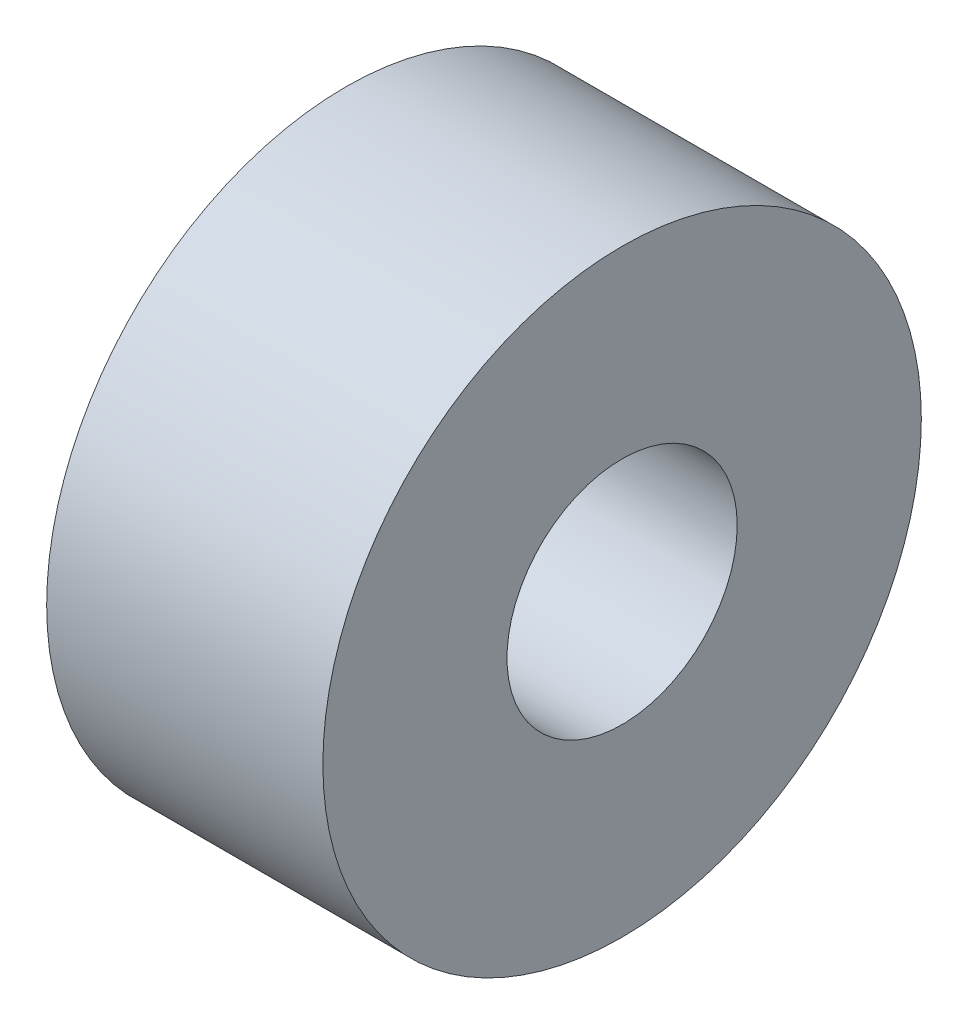
from build123d import *

# Parameters (mm, degrees)
SKETCH_1_R      = 65
SKETCH_1_R_2    = 25
EXTRUDE_1_DEPTH = 60


with BuildPart() as part:
    # 草图1 → 凸台-拉伸1 (new body)
    with BuildSketch(Plane(origin=(0, 0, 0), x_dir=(0, 0, -1), z_dir=(1, 0, 0))):
        Circle(SKETCH_1_R)
        Circle(SKETCH_1_R_2, mode=Mode.SUBTRACT)
    extrude(amount=EXTRUDE_1_DEPTH)


solid = part.part
